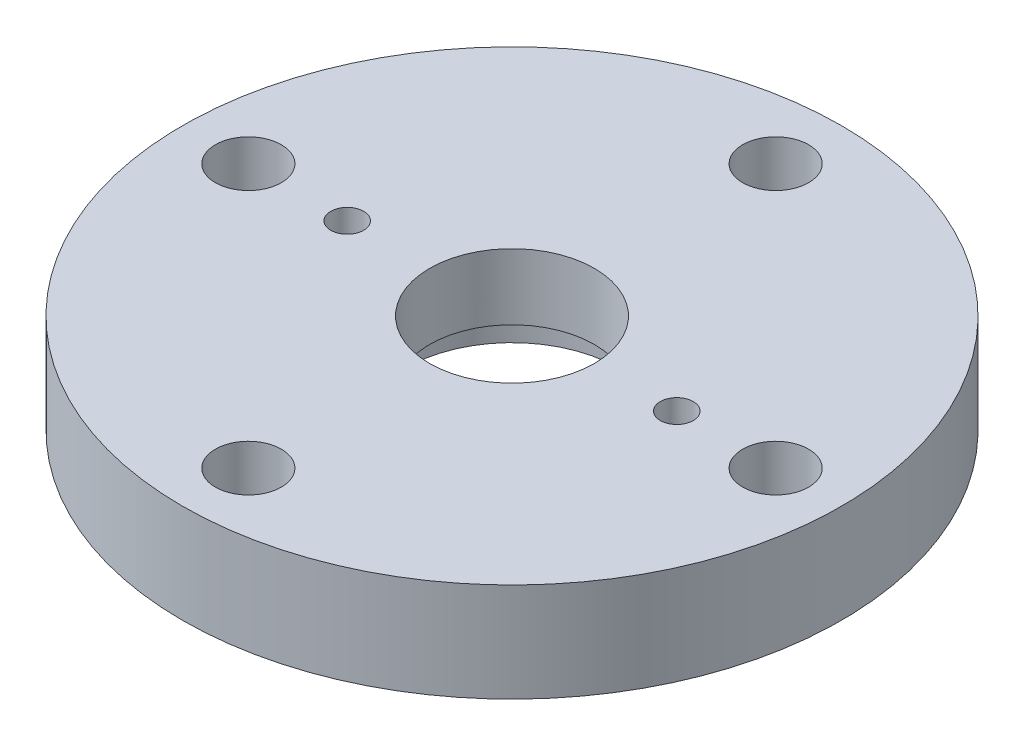
from build123d import *

# Parameters (mm, degrees)
SKETCH_1_R          = 10
EXTRUDE_1_DEPTH     = 3
SKETCH_2_R          = 1
SKETCH_2_R_2        = 0.5
CUT_EXTRUDE_1_DEPTH = 3
SKETCH_4_R          = 3.25
CUT_EXTRUDE_5_DEPTH = 1
CUT_EXTRUDE_6_REACH = 16.283
SKETCH_5_R          = 2.5


with BuildPart() as part:
    # 草图1 → 凸台-拉伸1 (new body)
    with BuildSketch(Plane(origin=(0, 0, 0), x_dir=(1, 0, 0), z_dir=(0, 1, 0))):
        with Locations(Location((0, 0, 0), (0, 0, 270))):
            Circle(SKETCH_1_R)
    extrude(amount=EXTRUDE_1_DEPTH)

    # 草图2 → 切除-拉伸1 (cut)
    with BuildSketch(Plane(origin=(0, 0, 0), x_dir=(1, 0, 0), z_dir=(0, 1, 0))):
        with Locations(Location((8, 0, 0), (0, 0, 270))):
            Circle(SKETCH_2_R)
        with Locations(Location((5, 0, 0), (0, 0, 270))):
            Circle(SKETCH_2_R_2)
        with Locations(Location((-5, 0, 0), (0, 0, 90))):
            Circle(SKETCH_2_R_2)
        with Locations(Location((-8, 0, 0), (0, 0, 90))):
            Circle(SKETCH_2_R)
        with Locations(Location((0, 8, 0), (0, 0, 90))):
            Circle(SKETCH_2_R)
        with Locations(Location((0, -8, 0), (0, 0, 270))):
            Circle(SKETCH_2_R)
    extrude(amount=CUT_EXTRUDE_1_DEPTH, mode=Mode.SUBTRACT)

    # 草图4 → 切除-拉伸5 (cut)
    with BuildSketch(Plane(origin=(0, 0, 0), x_dir=(1, 0, 0), z_dir=(0, 1, 0))):
        with Locations(Location((0, 0, 0), (0, 0, 270))):
            Circle(SKETCH_4_R)
    extrude(amount=CUT_EXTRUDE_5_DEPTH, mode=Mode.SUBTRACT)

    # 草图5 → 切除-拉伸6 (cut, up to next)
    with BuildSketch(Plane.XZ.offset(-1), mode=Mode.PRIVATE) as cut_extrude_6_sk1:
        with Locations(Location((0, 0, 0), (0, 0, 270))):
            Circle(SKETCH_5_R)
    cut_extrude_6_tool1 = extrude(cut_extrude_6_sk1.sketch, amount=-CUT_EXTRUDE_6_REACH, mode=Mode.PRIVATE) & part.part
    add(cut_extrude_6_tool1.solids().sort_by_distance((0, 1, 0))[0], mode=Mode.SUBTRACT)


solid = part.part
